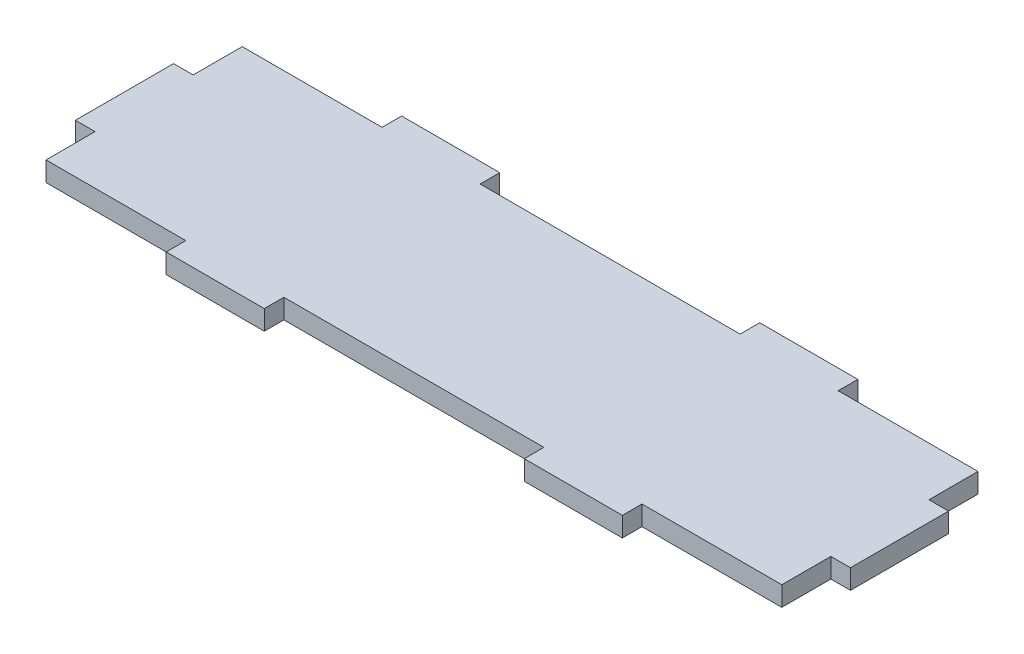
from build123d import *

# Parameters (mm, degrees)
SALIENTE_EXTRUIR1_DEPTH = 4


with BuildPart() as part:
    # Croquis1 → Saliente-Extruir1 (new body)
    with BuildSketch(Plane(origin=(0, 0, 0), x_dir=(1, 0, 0), z_dir=(0, 1, 0))):
        Polygon((0, 0), (28.5, 0), (28.5, -4), (48.5, -4), (48.5, 0), (101.5, 0), (101.5, -4), (121.5, -4), (121.5, 0), (150, 0), (150, 10), (154, 10), (154, 30), (150, 30), (150, 40), (121.5, 40), (121.5, 44), (101.5, 44), (101.5, 40), (48.5, 40), (48.5, 44), (28.5, 44), (28.5, 40), (0, 40), (0, 30), (-4, 30), (-4, 10), (0, 10), align=None)
    extrude(amount=SALIENTE_EXTRUIR1_DEPTH)


solid = part.part
